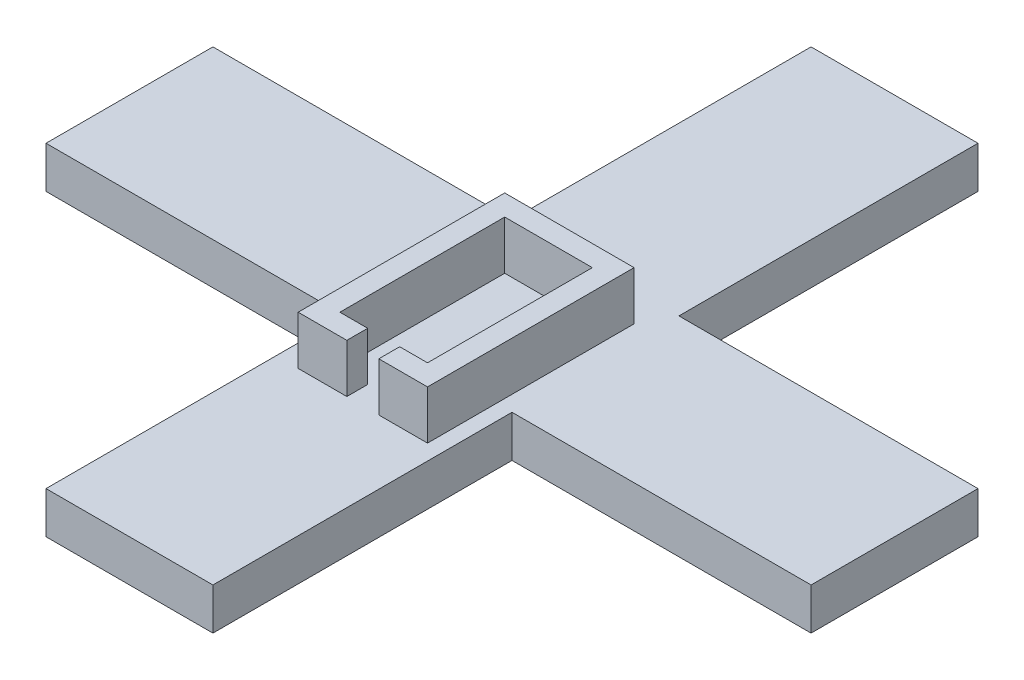
from build123d import *

# Parameters (mm, degrees)
BOSS_EXTRUDE18_DEPTH = 6
SKETCH22_R           = 12
BOSS_EXTRUDE19_DEPTH = 6
BOSS_EXTRUDE20_DEPTH = 13


with BuildPart() as part:
    # Sketch21 → Boss-Extrude18 (new body)
    with BuildSketch(Plane(origin=(0, 0, 0), x_dir=(1, 0, 0), z_dir=(0, 1, 0))):
        Polygon((0, 55), (-12, 55), (-12, 12), (-55, 12), (-55, 0), (-55, -12), (-12, -12), (-12, -55), (0, -55), (12, -55), (12, -12), (55, -12), (55, 0), (55, 12), (12, 12), (12, 55), align=None)
    extrude(amount=BOSS_EXTRUDE18_DEPTH)

    # Sketch22 → Boss-Extrude19 (add)
    with BuildSketch(Plane(origin=(0, 0, 0), x_dir=(1, 0, 0), z_dir=(0, 1, 0))):
        Circle(SKETCH22_R)
    extrude(amount=BOSS_EXTRUDE19_DEPTH)

    # Sketch16 → Boss-Extrude20 (add)
    with BuildSketch(Plane(origin=(0, 0, 0), x_dir=(1, 0, 0), z_dir=(0, 1, 0))):
        Polygon((-8.834281574, 7.787269814), (9.765718426, 7.787269814), (9.765718426, -21.912730186), (2.765718426, -21.912730186), (2.765718426, -18.912730186), (6.765718426, -18.912730186), (6.765718426, 4.787269814), (-5.834281574, 4.787269814), (-5.834281574, -18.912730186), (-1.834281574, -18.912730186), (-1.834281574, -21.912730186), (-8.834281574, -21.912730186), align=None)
    extrude(amount=BOSS_EXTRUDE20_DEPTH)


solid = part.part
